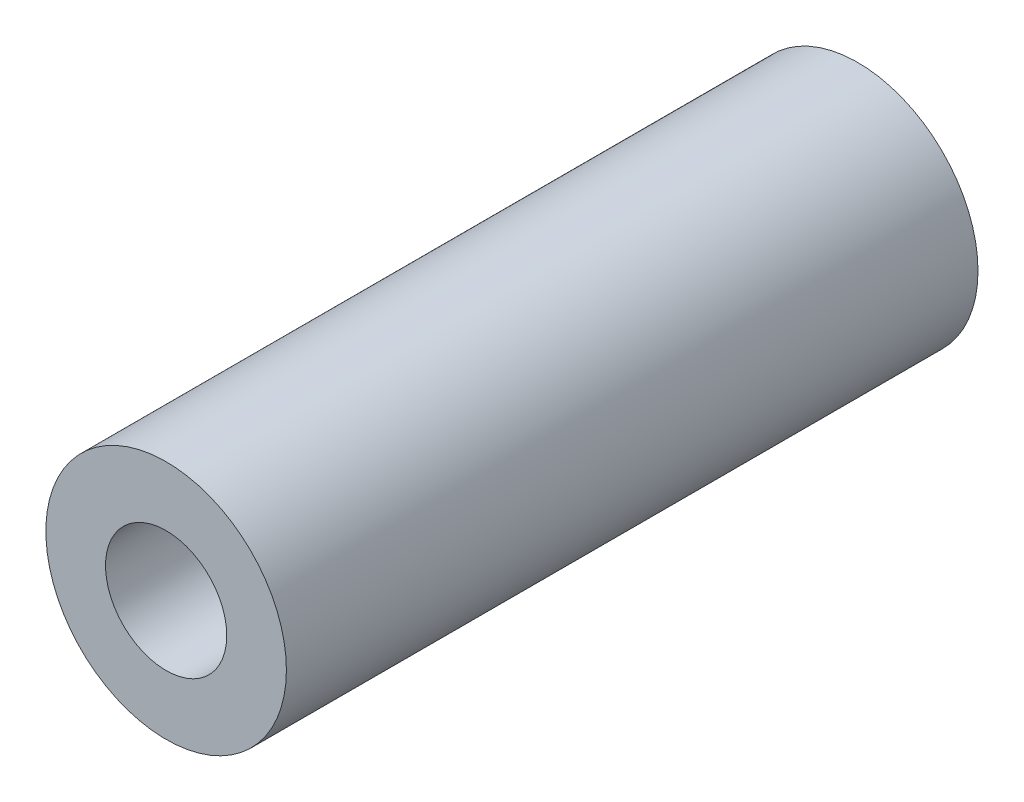
from build123d import *

# Parameters (mm, degrees)
EXTRUDE1_DEPTH      = 18.25625
EXTRUDE1_DEPTH_BACK = 18.25625
SKETCH1_R           = 6.35
SKETCH1_R_2         = 3.2004


with BuildPart() as part:
    # Sketch1 → Extrude1 (new, two sides: drawn at the far end of the back side and taken through both)
    with BuildSketch(Plane.XY.offset(-EXTRUDE1_DEPTH_BACK)):
        Circle(SKETCH1_R)
        Circle(SKETCH1_R_2, mode=Mode.SUBTRACT)
    extrude(amount=EXTRUDE1_DEPTH + EXTRUDE1_DEPTH_BACK)


solid = part.part
